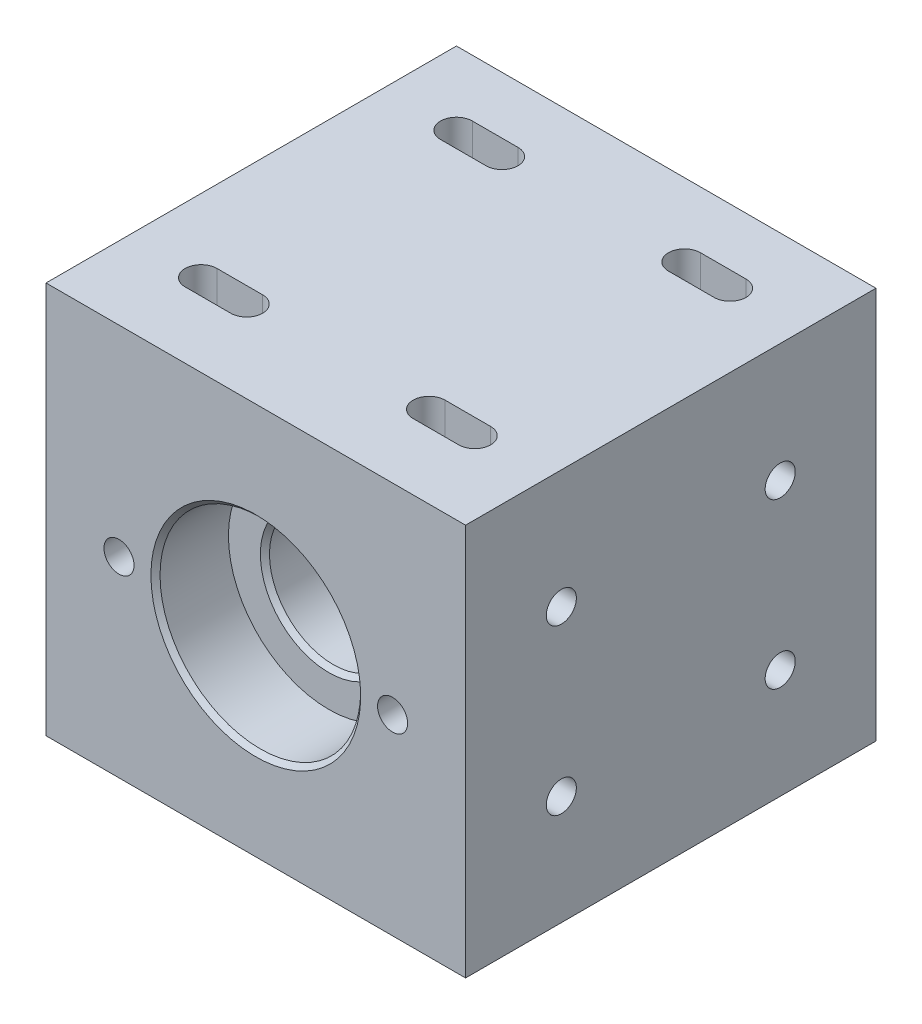
from build123d import *

# Parameters (mm, degrees)
SKETCH1_W           = 46
SKETCH1_H           = 32
SKETCH1_R           = 7
BOSS_EXTRUDE1_DEPTH = 22.5
SKETCH2_R           = 11
CUT_EXTRUDE1_DEPTH  = 8
CUT_EXTRUDE2_START  = -8
SKETCH3_R           = 11
CUT_EXTRUDE2_DEPTH  = 8
SKETCH4_R           = 1.65
CUT_EXTRUDE3_DEPTH  = 10
CHAMFER1_SIZE       = 0.5
SKETCH5_W           = 46
SKETCH5_H           = 45
BOSS_EXTRUDE2_DEPTH = 6
SKETCH6_R           = 1.65
CUT_EXTRUDE4_DEPTH  = 8
SKETCH8_W           = 46
SKETCH8_H           = 45
BOSS_EXTRUDE3_DEPTH = 5


with BuildPart() as part:
    # Sketch1 → Boss-Extrude1 (new, symmetric)
    with BuildSketch(Plane.XY):
        Rectangle(SKETCH1_W, SKETCH1_H)
        with Locations(Location((0, 0, 0), (0, 0, 180))):
            Circle(SKETCH1_R, mode=Mode.SUBTRACT)
    extrude(amount=BOSS_EXTRUDE1_DEPTH, both=True)

    # Sketch2 → Cut-Extrude1 (cut)
    with BuildSketch(Plane.XY.offset(22.5)):
        Circle(SKETCH2_R)
    extrude(amount=-CUT_EXTRUDE1_DEPTH, mode=Mode.SUBTRACT)

    # Sketch3 → Cut-Extrude2 (cut)
    with BuildSketch(Plane(origin=(0, 0, -22.5), x_dir=(-1, 0, 0), z_dir=(0, 0, -1)).offset(CUT_EXTRUDE2_START)):
        with Locations(Location((0, 0, 0), (0, 0, 180))):
            Circle(SKETCH3_R)
    extrude(amount=CUT_EXTRUDE2_DEPTH, mode=Mode.SUBTRACT)

    # Sketch4 → Cut-Extrude3 (cut)
    with BuildSketch(Plane.ZY.offset(23)):
        with Locations((12, -9)):
            Circle(SKETCH4_R)
        with Locations((12, 9)):
            Circle(SKETCH4_R)
        with Locations((-12, -9)):
            Circle(SKETCH4_R)
        with Locations((-12, 9)):
            Circle(SKETCH4_R)
    cut_extrude3 = extrude(amount=-CUT_EXTRUDE3_DEPTH, mode=Mode.SUBTRACT)

    # Mirror1: Cut-Extrude3 across plane
    add(cut_extrude3.mirror(Plane(origin=(0, 0, 0), x_dir=(0, 0, 1), z_dir=(1, 0, 0))), mode=Mode.SUBTRACT)

    # Chamfer1
    chamfer1_edges = [part.edges().sort_by_distance(p)[0] for p in [
        (7, 0, 14.5),
        (-11, 0, 22.5),
        (7, 0, -14.5),
        (-11, 0, -22.5),
    ]]
    chamfer(chamfer1_edges, length=CHAMFER1_SIZE)

    # Sketch5 → Boss-Extrude2 (add)
    with BuildSketch(Plane(origin=(0, 16, 0), x_dir=(1, 0, 0), z_dir=(0, 1, 0))):
        Rectangle(SKETCH5_W, SKETCH5_H)
        with BuildLine():
            Line((-10, -15.25), (-15, -15.25))
            ThreePointArc((-15, -15.25), (-16.75, -13.5), (-15, -11.75))
            Line((-15, -11.75), (-10, -11.75))
            ThreePointArc((-10, -11.75), (-8.25, -13.5), (-10, -15.25))
        make_face(mode=Mode.SUBTRACT)
        with BuildLine():
            Line((10, 16.25), (15, 16.25))
            ThreePointArc((15, 16.25), (16.75, 14.5), (15, 12.75))
            Line((15, 12.75), (10, 12.75))
            ThreePointArc((10, 12.75), (8.25, 14.5), (10, 16.25))
        make_face(mode=Mode.SUBTRACT)
        with BuildLine():
            Line((15, -11.75), (10, -11.75))
            ThreePointArc((10, -11.75), (8.25, -13.5), (10, -15.25))
            Line((10, -15.25), (15, -15.25))
            ThreePointArc((15, -15.25), (16.75, -13.5), (15, -11.75))
        make_face(mode=Mode.SUBTRACT)
        with BuildLine():
            Line((-15, 12.75), (-10, 12.75))
            ThreePointArc((-10, 12.75), (-8.25, 14.5), (-10, 16.25))
            Line((-10, 16.25), (-15, 16.25))
            ThreePointArc((-15, 16.25), (-16.75, 14.5), (-15, 12.75))
        make_face(mode=Mode.SUBTRACT)
    extrude(amount=BOSS_EXTRUDE2_DEPTH)

    # Sketch6 → Cut-Extrude4 (cut)
    with BuildSketch(Plane(origin=(0, 0, -22.5), x_dir=(-1, 0, 0), z_dir=(0, 0, -1))):
        with Locations((15, 0)):
            Circle(SKETCH6_R)
        with Locations((-15, 0)):
            Circle(SKETCH6_R)
    cut_extrude4 = extrude(amount=-CUT_EXTRUDE4_DEPTH, mode=Mode.SUBTRACT)

    # Mirror2: Cut-Extrude4 across plane
    add(cut_extrude4.mirror(Plane.XY), mode=Mode.SUBTRACT)

    # Sketch8 → Boss-Extrude3 (add)
    with BuildSketch(Plane.XZ.offset(16)):
        Rectangle(SKETCH8_W, SKETCH8_H)
    extrude(amount=BOSS_EXTRUDE3_DEPTH)


solid = part.part
